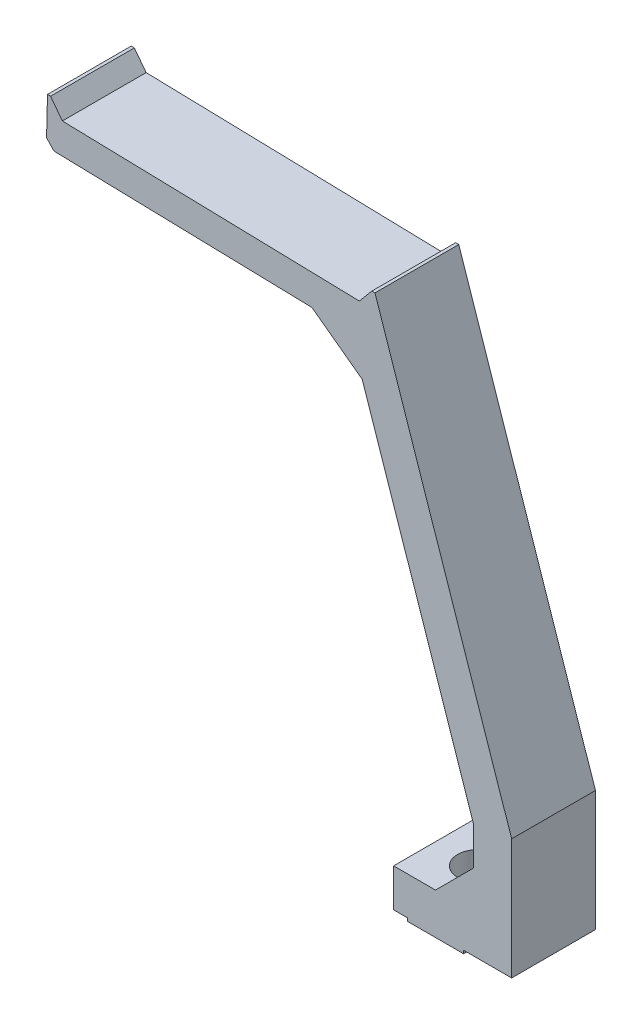
from build123d import *

# Parameters (mm, degrees)
EXTRUDE_1_DEPTH     = 11
CHAMFER_2_SIZE      = 5
CHAMFER_3_SIZE      = 1
SKETCH_2_R          = 2.6
CUT_EXTRUDE_1_DEPTH = 84.385355554
SKETCH_3_R          = 5
CUT_EXTRUDE_2_DEPTH = 5


with BuildPart() as part:
    # Эскиз1 → Бобышка-Вытянуть1 (new body)
    with BuildSketch(Plane.XY):
        Polygon((-5.5, 0.4), (-3.7, 0.4), (-3.7, 0), (3.7, 0), (3.7, 0.4), (10, 0.4), (10, 16.222307726), (-7.950469523, 69.319681931), (-8.350343704, 69.329713846), (-10, 67.370470597), (-48.987732655, 68.348582239), (-50.537069808, 70.388080802), (-50.93694399, 70.398112716), (-51.087422704, 64.4), (-11.227215564, 63.4), (5, 15.4), (5, 5.4), (-5.5, 5.4), align=None)
    extrude(amount=EXTRUDE_1_DEPTH)

    # Фаска2
    chamfer_2_edges = [part.edges().sort_by_distance(p)[0] for p in [
        (5, 5.4, 5.5),
        (-11.227215564, 63.4, 5.5),
    ]]
    chamfer(chamfer_2_edges, length=CHAMFER_2_SIZE)

    # Фаска3
    chamfer_3_edges = [part.edges().sort_by_distance(p)[0] for p in [
        (-51.087422704, 64.4, 5.5),
    ]]
    chamfer(chamfer_3_edges, length=CHAMFER_3_SIZE)

    # Эскиз2 → Вырез-Вытянуть1 (cut, through all)
    with BuildSketch(Plane(origin=(0, 5.4, 0), x_dir=(1, 0, 0), z_dir=(0, 1, 0))):
        with Locations(Location((0, -5.5, 0), (0, 0, 270))):
            Circle(SKETCH_2_R)
    extrude(amount=-CUT_EXTRUDE_1_DEPTH, mode=Mode.SUBTRACT)

    # Эскиз3 → Вырез-Вытянуть2 (cut)
    with BuildSketch(Plane(origin=(0, 5.4, 0), x_dir=(1, 0, 0), z_dir=(0, 1, 0))):
        with Locations((0, -5.5)):
            Circle(SKETCH_3_R)
    extrude(amount=CUT_EXTRUDE_2_DEPTH, mode=Mode.SUBTRACT)


solid = part.part
